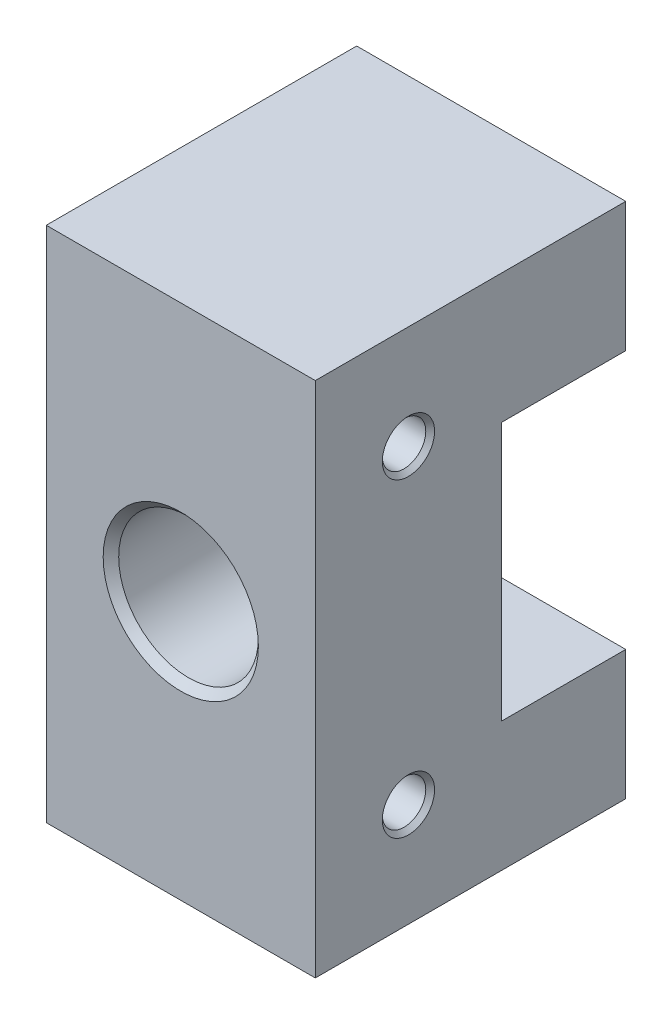
from build123d import *

# Parameters (mm, degrees)
SKETCH1_W                      = 26
SKETCH1_H                      = 50
BOSS_EXTRUDE1_DEPTH            = 30
SKETCH2_W                      = 26
SKETCH2_H                      = 25
CUT_EXTRUDE1_DEPTH             = 12
M5X0_8_TAPPED_HOLE1_AT_2_COUNT = 2
M5X0_8_TAPPED_HOLE1_AT_2_PITCH = 30


with BuildPart() as part:
    # Sketch1 → Boss-Extrude1 (new body)
    with BuildSketch(Plane.XY):
        Rectangle(SKETCH1_W, SKETCH1_H)
    extrude(amount=BOSS_EXTRUDE1_DEPTH)

    # Sketch2 → Cut-Extrude1 (cut)
    with BuildSketch(Plane.XY):
        Rectangle(SKETCH2_W, SKETCH2_H)
    extrude(amount=CUT_EXTRUDE1_DEPTH, mode=Mode.SUBTRACT)

    # Sketch8 → M12 Clearance Hole1 (revolve, cut)
    with BuildSketch(Plane(origin=(0, 0, 12), x_dir=(0, 1, 0), z_dir=(1, 0, 0))):
        Polygon((0, 0), (0, 18), (7.5, 18), (6.75, 17.25), (6.75, 0.75), (7.5, 0), align=None)
    revolve(axis=Axis((0, 0, 5.65), (0, 0, 1)), mode=Mode.SUBTRACT)

    # Sketch11 → M5x0.8 Tapped Hole1 (revolve, cut)
    with BuildSketch(Plane(origin=(13, 15, 21), x_dir=(0, 0, -1), z_dir=(0, 1, 0))):
        Polygon((0, 0), (0, 12), (2.1, 10.7381927), (2.1, 0.425), (2.525, 0), align=None)
    m5x0_8_tapped_hole1 = revolve(axis=Axis((19.35, 15, 21), (-1, 0, 0)), mode=Mode.SUBTRACT)

    # M5x0.8 Tapped Hole1 at 2: M5x0.8 Tapped Hole1 ×2
    with Locations(*[(0, -i * M5X0_8_TAPPED_HOLE1_AT_2_PITCH, 0) for i in range(1, M5X0_8_TAPPED_HOLE1_AT_2_COUNT)]):
        add(m5x0_8_tapped_hole1, mode=Mode.SUBTRACT)

    # Mirror1: M5x0.8 Tapped Hole1 across plane
    add(m5x0_8_tapped_hole1.mirror(Plane(origin=(0, 0, 0), x_dir=(0, 0, 1), z_dir=(1, 0, 0))), mode=Mode.SUBTRACT)

    # Mirror1 copy 1 sketch → Mirror1 copy 1 (revolve, cut)
    with BuildSketch(Plane(origin=(-13, -15, 21), x_dir=(0, 0, -1), z_dir=(0, 1, 0))):
        Polygon((0, 0), (0, -12), (2.1, -10.7381927), (2.1, -0.425), (2.525, 0), align=None)
    revolve(axis=Axis((-19.35, -15, 21), (-1, 0, 0)), mode=Mode.SUBTRACT)


solid = part.part
